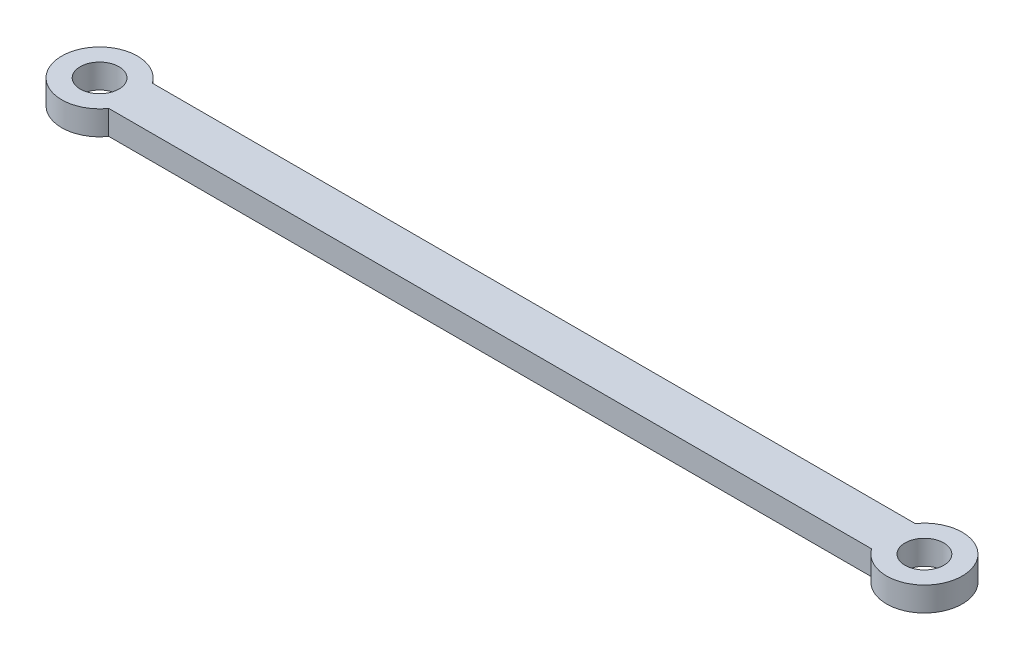
from build123d import *

# Parameters (mm, degrees)
SKETCH1_R           = 4
BOSS_EXTRUDE1_DEPTH = 5


with BuildPart() as part:
    # Sketch1 → Boss-Extrude1 (new body)
    with BuildSketch(Plane(origin=(0, 0, 0), x_dir=(1, 0, 0), z_dir=(0, 1, 0))):
        with BuildLine():
            Line((-78.616427333, -4.5), (78.616427333, -4.5))
            ThreePointArc((78.616427333, -4.5), (92.810249676, 0), (78.616427333, 4.5))
            Line((78.616427333, 4.5), (-78.616427333, 4.5))
            ThreePointArc((-78.616427333, 4.5), (-92.810249676, 0), (-78.616427333, -4.5))
        make_face()
        with Locations(Location((85, 0, 0), (0, 0, 270))):
            Circle(SKETCH1_R, mode=Mode.SUBTRACT)
        with Locations(Location((-85, 0, 0), (0, 0, 90))):
            Circle(SKETCH1_R, mode=Mode.SUBTRACT)
    extrude(amount=BOSS_EXTRUDE1_DEPTH)


solid = part.part
